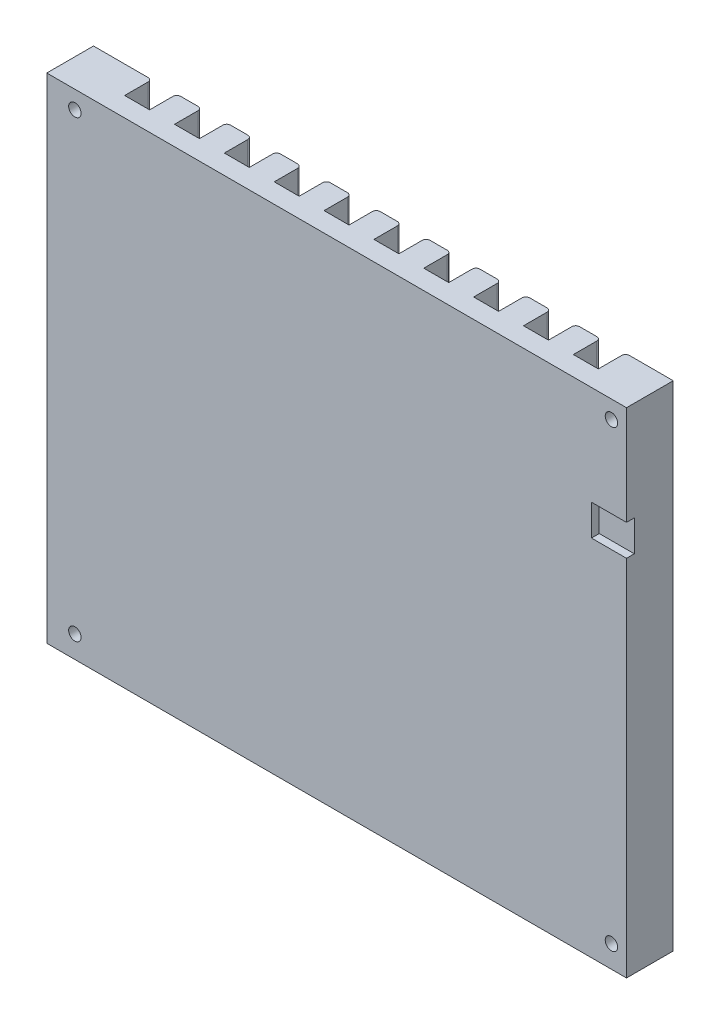
from build123d import *

# Parameters (mm, degrees)
SKETCH_1_W               = 74.42
SKETCH_1_H               = 63.4
EXTRUDE_1_DEPTH          = 6
SKETCH_1_3_W             = 4.5
SKETCH_1_3_H             = 3.99
CUT_EXTRUDE_1_DEPTH      = 1
HOLE_WIZARD_M2_10_D      = 1.6
CUT_EXTRUDE_2_DEPTH      = 98.948437456
CUT_EXTRUDE_2_DEPTH_BACK = 98.948437456
SKETCH_19_W              = 3.2
SKETCH_19_H              = 3.5
FILLET_2_R               = 0.5


with BuildPart() as part:
    # 草图1 → 凸台-拉伸1 (new body)
    with BuildSketch(Plane.XY):
        with Locations((37.21, 31.7)):
            Rectangle(SKETCH_1_W, SKETCH_1_H)
    extrude(amount=-EXTRUDE_1_DEPTH)

    # 草图1<3> → 切除-拉伸1 (cut)
    with BuildSketch(Plane.XY):
        with Locations((72.17, 48.655)):
            Rectangle(SKETCH_1_3_W, SKETCH_1_3_H)
    extrude(amount=-CUT_EXTRUDE_1_DEPTH, mode=Mode.SUBTRACT)

    # M2 螺纹孔10 (through all)
    with Locations(Plane.XY):
        with Locations((3.61, 61.113), (72.488, 61.113), (72.488, 2.851), (3.61, 2.851)):
            Hole(HOLE_WIZARD_M2_10_D / 2)

    # 草图19 → 切除-拉伸2 (cut, two sides: drawn at the far end of the back side and taken through both)
    with BuildSketch(Plane.XZ.offset(-CUT_EXTRUDE_2_DEPTH_BACK)):
        with Locations((66.7, -4.25)):
            Rectangle(SKETCH_19_W, SKETCH_19_H)
        with Locations((60.3, -4.25)):
            Rectangle(SKETCH_19_W, SKETCH_19_H)
        with Locations((53.9, -4.25)):
            Rectangle(SKETCH_19_W, SKETCH_19_H)
        with Locations((47.5, -4.25)):
            Rectangle(SKETCH_19_W, SKETCH_19_H)
        with Locations((41.1, -4.25)):
            Rectangle(SKETCH_19_W, SKETCH_19_H)
        with Locations((34.7, -4.25)):
            Rectangle(SKETCH_19_W, SKETCH_19_H)
        with Locations((28.3, -4.25)):
            Rectangle(SKETCH_19_W, SKETCH_19_H)
        with Locations((21.9, -4.25)):
            Rectangle(SKETCH_19_W, SKETCH_19_H)
        with Locations((15.5, -4.25)):
            Rectangle(SKETCH_19_W, SKETCH_19_H)
        with Locations((9.1, -4.25)):
            Rectangle(SKETCH_19_W, SKETCH_19_H)
    extrude(amount=CUT_EXTRUDE_2_DEPTH + CUT_EXTRUDE_2_DEPTH_BACK, mode=Mode.SUBTRACT)

    # 圆角2
    fillet_2_edges = [part.edges().sort_by_distance(p)[0] for p in [
        (68.3, 31.7, -6),
        (61.9, 31.7, -6),
        (55.5, 31.7, -6),
        (49.1, 31.7, -6),
        (42.7, 31.7, -6),
        (36.3, 31.7, -6),
        (29.9, 31.7, -6),
        (23.5, 31.7, -6),
        (17.1, 31.7, -6),
        (10.7, 31.7, -6),
        (65.1, 31.7, -6),
        (58.7, 31.7, -6),
        (52.3, 31.7, -6),
        (45.9, 31.7, -6),
        (39.5, 31.7, -6),
        (33.1, 31.7, -6),
        (26.7, 31.7, -6),
        (20.3, 31.7, -6),
        (13.9, 31.7, -6),
        (7.5, 31.7, -6),
    ]]
    fillet(fillet_2_edges, radius=FILLET_2_R)


solid = part.part
